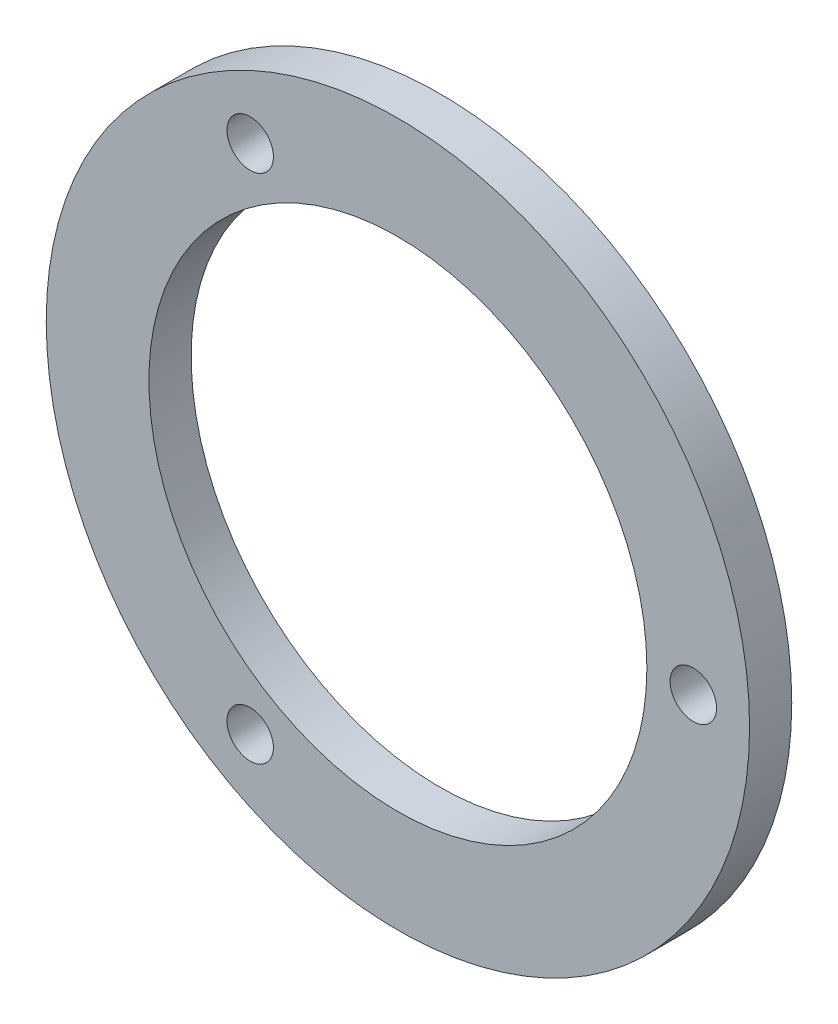
from build123d import *

# Parameters (mm, degrees)
SKETCH_1_R      = 25
SKETCH_1_R_2    = 17.7
SKETCH_1_R_3    = 1.65
EXTRUDE_1_DEPTH = 3


with BuildPart() as part:
    # 草图1 → 凸台-拉伸1 (new body)
    with BuildSketch(Plane.XY):
        Circle(SKETCH_1_R)
        Circle(SKETCH_1_R_2, mode=Mode.SUBTRACT)
        with Locations((21, 0)):
            Circle(SKETCH_1_R_3, mode=Mode.SUBTRACT)
        with Locations((-10.5, 18.186533479)):
            Circle(SKETCH_1_R_3, mode=Mode.SUBTRACT)
        with Locations((-10.5, -18.186533479)):
            Circle(SKETCH_1_R_3, mode=Mode.SUBTRACT)
    extrude(amount=EXTRUDE_1_DEPTH)


solid = part.part
